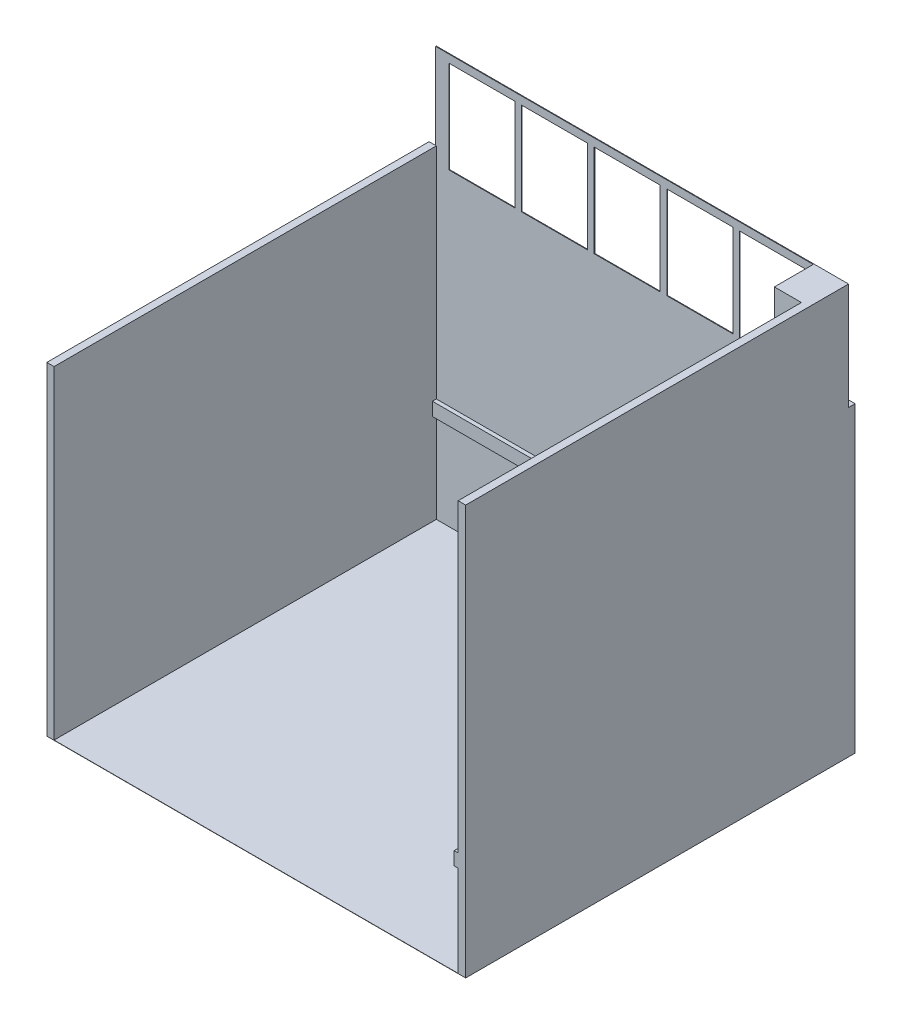
from build123d import *

# Parameters (mm, degrees)
CROQUIS1_W               = 3070
CROQUIS1_H               = 2900
SALIENTE_EXTRUIR1_DEPTH  = 2
CROQUIS4_W               = 5
CROQUIS4_H               = 2600
CROQUIS4_W_2             = 2860
CROQUIS4_H_2             = 5
SALIENTE_EXTRUIR3_DEPTH  = 3100
CROQUIS5_W               = 5
CROQUIS5_H               = 2895
SALIENTE_EXTRUIR4_DEPTH  = 2450
CROQUIS6_W               = 2855
CROQUIS6_H               = 100
SALIENTE_EXTRUIR5_DEPTH  = 30
CROQUIS7_W               = 300
CROQUIS7_H               = 100
SALIENTE_EXTRUIR6_DEPTH  = 30
CROQUIS8_W               = 235
CROQUIS8_H               = 100
SALIENTE_EXTRUIR7_DEPTH  = 30
CROQUIS9_W               = 2600
CROQUIS9_H               = 100
SALIENTE_EXTRUIR8_DEPTH  = 30
CROQUIS11_W              = 500
CROQUIS11_H              = 700
CORTAR_EXTRUIR1_DEPTH    = 30
CROQUIS18_W              = 2900
CROQUIS18_H              = 3102
SALIENTE_EXTRUIR9_DEPTH  = 2
CROQUIS23_W              = 2900
CROQUIS23_H              = 3102
SALIENTE_EXTRUIR10_DEPTH = 50
CROQUIS24_W              = 3117
CROQUIS24_H              = 2292
SALIENTE_EXTRUIR11_DEPTH = 50
CROQUIS25_W              = 2895
CROQUIS25_H              = 2452
SALIENTE_EXTRUIR12_DEPTH = 50


with BuildPart() as part:
    # Croquis1 → Saliente-Extruir1 (new body)
    with BuildSketch(Plane(origin=(0, 0, 0), x_dir=(1, 0, 0), z_dir=(0, 1, 0))):
        with Locations((-1494.5, -1450)):
            Rectangle(CROQUIS1_W, CROQUIS1_H)
    extrude(amount=SALIENTE_EXTRUIR1_DEPTH)

    # Croquis4 → Saliente-Extruir3 (add)
    with BuildSketch(Plane(origin=(0, 2, 0), x_dir=(1, 0, 0), z_dir=(0, 1, 0))):
        with Locations((38, -1600)):
            Rectangle(CROQUIS4_W, CROQUIS4_H)
        Polygon((40.5, -300), (40.5, 0), (-169.5, 0), (-169.5, -5), (-169.5, -300), (35.5, -300), align=None)
        with Locations((-1599.5, -2.5)):
            Rectangle(CROQUIS4_W_2, CROQUIS4_H_2)
    extrude(amount=SALIENTE_EXTRUIR3_DEPTH)

    # Croquis5 → Saliente-Extruir4 (add)
    with BuildSketch(Plane(origin=(0, 2, 0), x_dir=(1, 0, 0), z_dir=(0, 1, 0))):
        with Locations((-3027, -1452.5)):
            Rectangle(CROQUIS5_W, CROQUIS5_H)
    extrude(amount=SALIENTE_EXTRUIR4_DEPTH)

    # Croquis6 → Saliente-Extruir5 (add)
    with BuildSketch(Plane.XY.offset(5)):
        with Locations((-1597, 742)):
            Rectangle(CROQUIS6_W, CROQUIS6_H)
    extrude(amount=SALIENTE_EXTRUIR5_DEPTH)

    # Croquis7 → Saliente-Extruir6 (add)
    with BuildSketch(Plane.ZY.offset(169.5)):
        with Locations((150, 742)):
            Rectangle(CROQUIS7_W, CROQUIS7_H)
    extrude(amount=SALIENTE_EXTRUIR6_DEPTH)

    # Croquis8 → Saliente-Extruir7 (add)
    with BuildSketch(Plane.XY.offset(300)):
        with Locations((-82, 742)):
            Rectangle(CROQUIS8_W, CROQUIS8_H)
    extrude(amount=SALIENTE_EXTRUIR7_DEPTH)

    # Croquis9 → Saliente-Extruir8 (add)
    with BuildSketch(Plane.ZY.offset(-35.5)):
        with Locations((1600, 742)):
            Rectangle(CROQUIS9_W, CROQUIS9_H)
    extrude(amount=SALIENTE_EXTRUIR8_DEPTH)

    # Croquis11 → Cortar-Extruir1 (cut)
    with BuildSketch(Plane.XY.offset(5)):
        with Locations((-2678.905145956, 2692)):
            Rectangle(CROQUIS11_W, CROQUIS11_H)
        with Locations((-2128.905145956, 2692)):
            Rectangle(CROQUIS11_W, CROQUIS11_H)
        with Locations((-1578.905145956, 2692)):
            Rectangle(CROQUIS11_W, CROQUIS11_H)
        with Locations((-1028.905145956, 2692)):
            Rectangle(CROQUIS11_W, CROQUIS11_H)
        with Locations((-478.905145956, 2692)):
            Rectangle(CROQUIS11_W, CROQUIS11_H)
    extrude(amount=-CORTAR_EXTRUIR1_DEPTH, mode=Mode.SUBTRACT)

    # Croquis18 → Saliente-Extruir9 (add)
    with BuildSketch(Plane(origin=(40.5, 0, 0), x_dir=(0, 0, -1), z_dir=(1, 0, 0))):
        with Locations((-1450, 1551)):
            Rectangle(CROQUIS18_W, CROQUIS18_H)
    extrude(amount=SALIENTE_EXTRUIR9_DEPTH)

    # Croquis23 → Saliente-Extruir10 (add)
    with BuildSketch(Plane(origin=(42.5, 0, 0), x_dir=(0, 0, -1), z_dir=(1, 0, 0))):
        with Locations((-1450, 1551)):
            Rectangle(CROQUIS23_W, CROQUIS23_H)
    extrude(amount=SALIENTE_EXTRUIR10_DEPTH)

    # Croquis24 → Saliente-Extruir11 (add)
    with BuildSketch(Plane(origin=(0, 0, 0), x_dir=(-1, 0, 0), z_dir=(0, 0, -1))):
        with Locations((1466, 1146)):
            Rectangle(CROQUIS24_W, CROQUIS24_H)
    extrude(amount=SALIENTE_EXTRUIR11_DEPTH)

    # Croquis25 → Saliente-Extruir12 (add)
    with BuildSketch(Plane.ZY.offset(3029.5)):
        with Locations((1452.5, 1226)):
            Rectangle(CROQUIS25_W, CROQUIS25_H)
    extrude(amount=SALIENTE_EXTRUIR12_DEPTH)


solid = part.part
